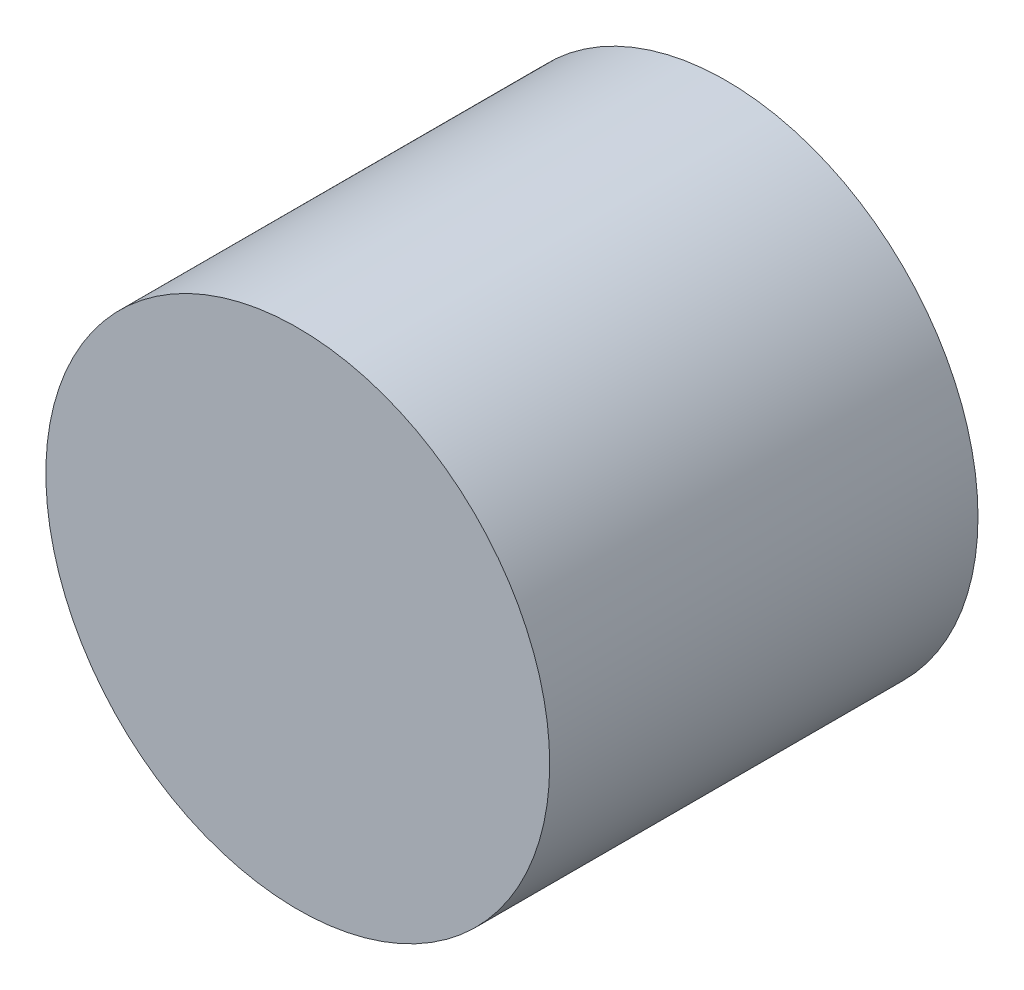
from build123d import *

# Parameters (mm, degrees)
SKETCH1_R           = 10
BOSS_EXTRUDE1_DEPTH = 17
SKETCH2_R           = 7.5
CUT_EXTRUDE1_DEPTH  = 3.5
CUT_EXTRUDE2_DEPTH  = 7


with BuildPart() as part:
    # Sketch1 → Boss-Extrude1 (new body)
    with BuildSketch(Plane.XY):
        Circle(SKETCH1_R)
    extrude(amount=BOSS_EXTRUDE1_DEPTH)

    # Sketch2 → Cut-Extrude1 (cut)
    with BuildSketch(Plane(origin=(0, 0, 0), x_dir=(-1, 0, 0), z_dir=(0, 0, -1))):
        Circle(SKETCH2_R)
    extrude(amount=-CUT_EXTRUDE1_DEPTH, mode=Mode.SUBTRACT)

    # Sketch4 → Cut-Extrude2 (cut)
    with BuildSketch(Plane(origin=(0, 0, 3.5), x_dir=(-1, 0, 0), z_dir=(0, 0, -1))):
        with BuildLine():
            Line((-3.059411708, 0.5), (3.059411708, 0.5))
            ThreePointArc((3.059411708, 0.5), (0, 3.1), (-3.059411708, 0.5))
        make_face()
        with BuildLine():
            Line((-3.059411708, -0.5), (3.059411708, -0.5))
            ThreePointArc((3.059411708, -0.5), (0, -3.1), (-3.059411708, -0.5))
        make_face()
    extrude(amount=-CUT_EXTRUDE2_DEPTH, mode=Mode.SUBTRACT)


solid = part.part
